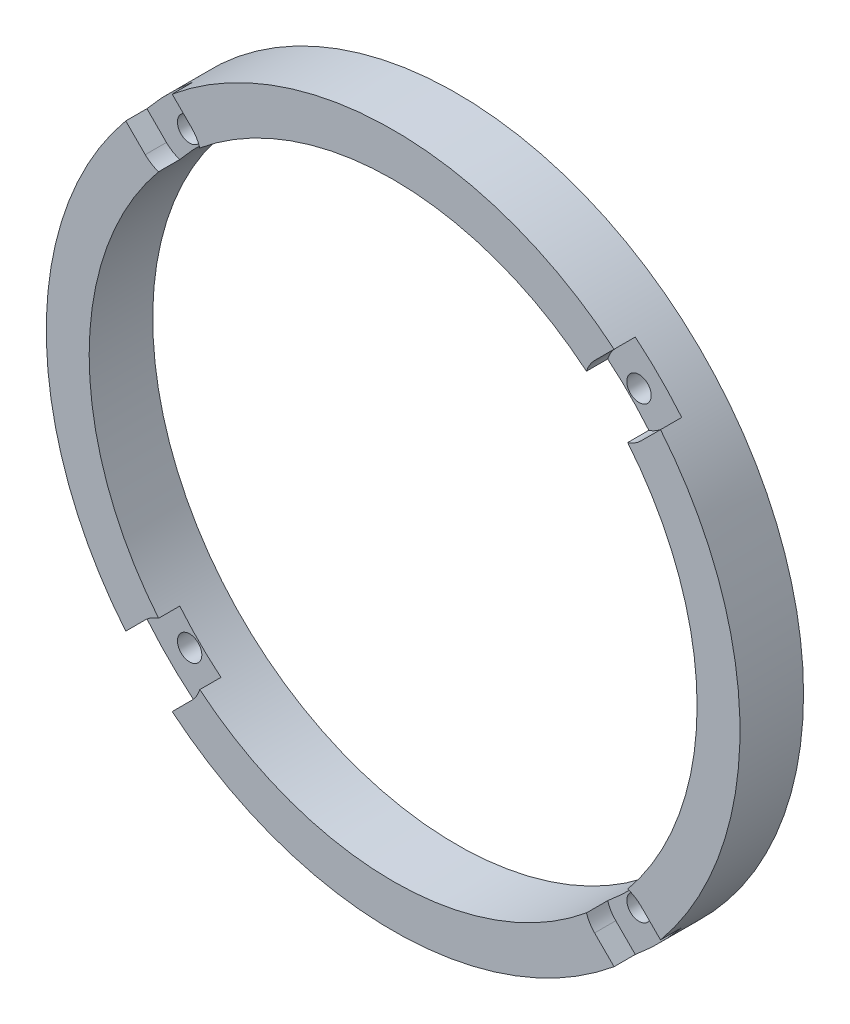
from build123d import *

# Parameters (mm, degrees)
SKETCH1_R           = 32.75
SKETCH1_R_2         = 28.7
BOSS_EXTRUDE1_DEPTH = 6
CUT_EXTRUDE1_START  = -2
CUT_EXTRUDE1_DEPTH  = 4
SKETCH2_7_R         = 1.150000003
CUT_EXTRUDE3_DEPTH  = 10


with BuildPart() as part:
    # Sketch1 → Boss-Extrude1 (new body)
    with BuildSketch(Plane.XY):
        Circle(SKETCH1_R)
        Circle(SKETCH1_R_2, mode=Mode.SUBTRACT)
    extrude(amount=BOSS_EXTRUDE1_DEPTH)

    # Sketch2 → Cut-Extrude1 (cut)
    with BuildSketch(Plane.XY.offset(6).offset(CUT_EXTRUDE1_START)):
        with BuildLine():
            ThreePointArc((-20.861737651, 25.245799694), (-23.157747084, 23.157747084), (-25.245799694, 20.861737651))
            Line((-25.245799694, 20.861737651), (-23.40529254, 19.021230496))
            ThreePointArc((-23.40529254, 19.021230496), (-22.471587987, 18.380133477), (-21.369913272, 18.117222076))
            Line((-21.369913272, 18.117222076), (-21.855038092, 18.602346895))
            ThreePointArc((-21.855038092, 18.602346895), (-21.70970764, 18.771749897), (-21.563064144, 18.940017548))
            ThreePointArc((-21.563064144, 18.940017548), (-19.586915918, 19.586915918), (-18.940017548, 21.563064144))
            ThreePointArc((-18.940017548, 21.563064144), (-18.771749897, 21.70970764), (-18.602346895, 21.855038092))
            Line((-18.602346895, 21.855038092), (-18.117222076, 21.369913272))
            ThreePointArc((-18.117222076, 21.369913272), (-18.380133477, 22.471587987), (-19.021230496, 23.40529254))
            Line((-19.021230496, 23.40529254), (-20.861737651, 25.245799694))
        make_face()
        with BuildLine():
            Line((20.861737651, 25.245799694), (19.021230496, 23.40529254))
            ThreePointArc((19.0212305, 23.405292536), (18.380133483, 22.471587987), (18.117222082, 21.369913278))
            Line((18.117222082, 21.369913278), (18.602346895, 21.855038092))
            ThreePointArc((18.602346895, 21.855038092), (18.771749898, 21.709707639), (18.940017551, 21.563064142))
            ThreePointArc((18.940017551, 21.563064142), (19.58691592, 19.58691592), (21.563064142, 18.940017551))
            ThreePointArc((21.563064142, 18.940017551), (21.709707639, 18.771749898), (21.855038092, 18.602346895))
            Line((21.855038092, 18.602346895), (21.369913278, 18.117222082))
            ThreePointArc((21.369913278, 18.117222082), (22.471587987, 18.380133483), (23.405292536, 19.0212305))
            Line((23.40529254, 19.021230496), (25.245799694, 20.861737651))
            ThreePointArc((25.245799694, 20.861737651), (23.157747084, 23.157747084), (20.861737651, 25.245799694))
        make_face()
        with BuildLine():
            Line((-23.40529254, -19.021230496), (-25.245799694, -20.861737651))
            ThreePointArc((-25.245799694, -20.861737651), (-23.157747084, -23.157747084), (-20.861737651, -25.245799694))
            Line((-20.861737651, -25.245799694), (-19.021230496, -23.40529254))
            ThreePointArc((-19.021230492, -23.405292544), (-18.38013347, -22.471587986), (-18.11722207, -21.369913266))
            Line((-18.11722207, -21.369913266), (-18.602346895, -21.855038092))
            ThreePointArc((-18.602346895, -21.855038092), (-18.771749899, -21.709707638), (-18.940017553, -21.56306414))
            ThreePointArc((-18.940017553, -21.56306414), (-19.586915922, -19.586915922), (-21.56306414, -18.940017553))
            ThreePointArc((-21.56306414, -18.940017553), (-21.709707638, -18.7717499), (-21.855038092, -18.602346895))
            Line((-21.855038092, -18.602346895), (-21.369913266, -18.11722207))
            ThreePointArc((-21.369913266, -18.11722207), (-22.471587986, -18.38013347), (-23.405292544, -19.021230492))
        make_face()
        with BuildLine():
            Line((21.369913272, -18.117222076), (21.855038092, -18.602346895))
            ThreePointArc((21.855038092, -18.602346895), (21.709707639, -18.771749898), (21.563064142, -18.940017551))
            ThreePointArc((21.563064142, -18.940017551), (19.58691592, -19.58691592), (18.940017551, -21.563064142))
            ThreePointArc((18.940017551, -21.563064142), (18.771749898, -21.709707639), (18.602346895, -21.855038092))
            Line((18.602346895, -21.855038092), (18.117222076, -21.369913272))
            ThreePointArc((18.117222076, -21.369913272), (18.380133477, -22.471587987), (19.021230496, -23.40529254))
            Line((19.021230496, -23.40529254), (20.861737651, -25.245799694))
            ThreePointArc((20.861737651, -25.245799694), (23.157747084, -23.157747084), (25.245799694, -20.861737651))
            Line((25.245799694, -20.861737651), (23.40529254, -19.021230496))
            ThreePointArc((23.40529254, -19.021230496), (22.471587987, -18.380133477), (21.369913272, -18.117222076))
        make_face()
    extrude(amount=CUT_EXTRUDE1_DEPTH, mode=Mode.SUBTRACT)

    # Sketch2<7> → Cut-Extrude3 (cut)
    with BuildSketch(Plane.XY.offset(6)):
        with Locations((-21.213261518, 21.213261518)):
            Circle(SKETCH2_7_R)
        with Locations((21.213261518, 21.213261518)):
            Circle(SKETCH2_7_R)
        with Locations((21.213261518, -21.213261518)):
            Circle(SKETCH2_7_R)
        with Locations((-21.213261518, -21.213261518)):
            Circle(SKETCH2_7_R)
    extrude(amount=-CUT_EXTRUDE3_DEPTH, mode=Mode.SUBTRACT)


solid = part.part
